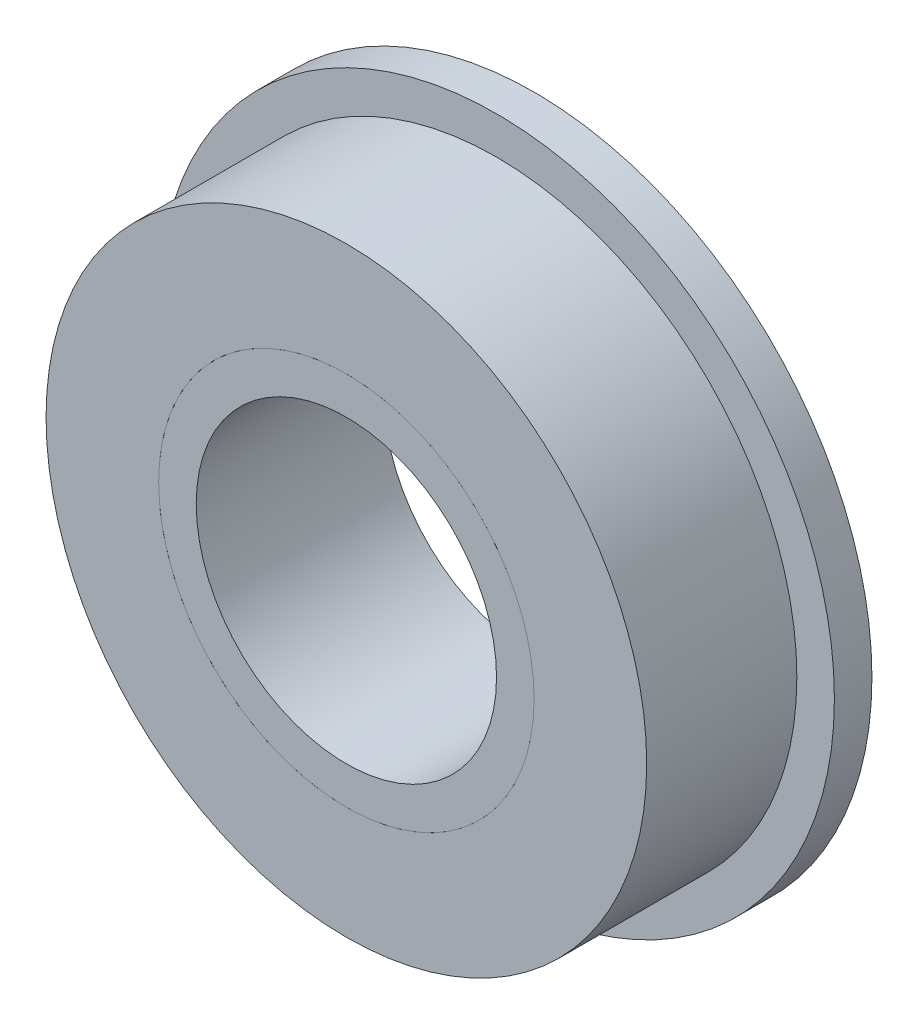
from build123d import *

# Parameters (mm, degrees)
SKETCH_1_R          = 9
SKETCH_1_R_2        = 5
EXTRUDE_1_DEPTH     = 5
CUT_EXTRUDE_START   = -4
SKETCH_2_R          = 9
SKETCH_2_R_2        = 8
CUT_EXTRUDE_1_DEPTH = 4
SKETCH_3_R          = 5
SKETCH_3_R_2        = 4
EXTRUDE_2_DEPTH     = 5


with BuildPart() as part:
    # Эскиз1 → Бобышка-Вытянуть1 (new body)
    with BuildSketch(Plane.XY):
        Circle(SKETCH_1_R)
        Circle(SKETCH_1_R_2, mode=Mode.SUBTRACT)
    extrude(amount=EXTRUDE_1_DEPTH)

    # Эскиз2 → Вырез-Вытянуть1 (cut)
    with BuildSketch(Plane.XY.offset(5).offset(CUT_EXTRUDE_START)):
        Circle(SKETCH_2_R)
        Circle(SKETCH_2_R_2, mode=Mode.SUBTRACT)
    extrude(amount=CUT_EXTRUDE_1_DEPTH, mode=Mode.SUBTRACT)


with BuildPart() as body_2:
    # Эскиз3 → Бобышка-Вытянуть2 (new body)
    with BuildSketch(Plane(origin=(0, 0, 0), x_dir=(-1, 0, 0), z_dir=(0, 0, -1))):
        Circle(SKETCH_3_R)
        Circle(SKETCH_3_R_2, mode=Mode.SUBTRACT)
    extrude(amount=-EXTRUDE_2_DEPTH)


solid = Compound([part.part, body_2.part])
